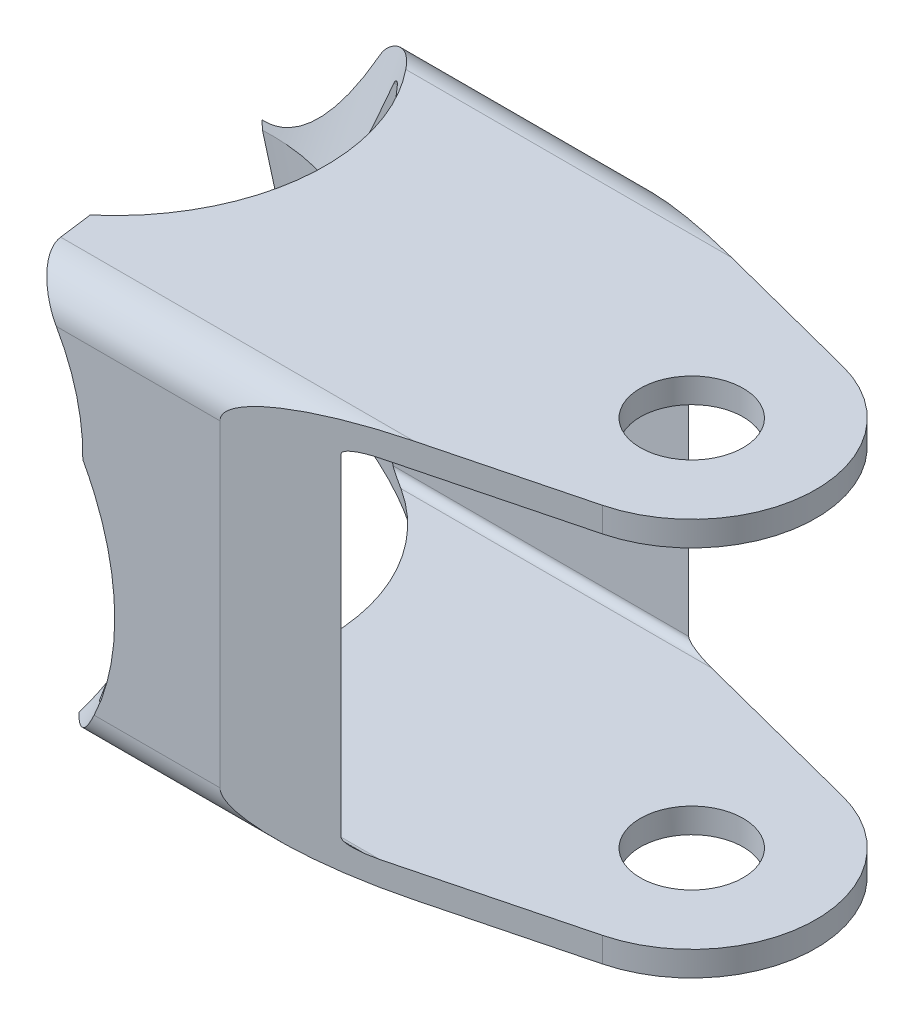
from build123d import *

# Parameters (mm, degrees)
BOSS_EXTRUDE1_DEPTH      = 25.4
BOSS_EXTRUDE1_DEPTH_BACK = 34.925
CUT_EXTRUDE4_DEPTH       = 63.941922635
CUT_EXTRUDE5_DEPTH       = 46.01339384
SKETCH14_R               = 3.2893
CUT_EXTRUDE6_DEPTH       = 46.01339384
CUT_EXTRUDE7_DEPTH       = 76.2
CUT_EXTRUDE7_DEPTH_BACK  = 12.7
SKETCH15_R               = 12.7
CUT_EXTRUDE8_DEPTH       = 10.668
CUT_EXTRUDE8_DEPTH_BACK  = 25.4
SKETCH16_R               = 12.7
CUT_EXTRUDE9_DEPTH       = 13.462
CUT_EXTRUDE9_DEPTH_BACK  = 25.4
SKETCH17_R               = 12.7
CUT_EXTRUDE10_DEPTH      = 11.43
CUT_EXTRUDE10_DEPTH_BACK = 25.4
SKETCH18_R               = 12.7
CUT_EXTRUDE11_DEPTH      = 10.668
CUT_EXTRUDE11_DEPTH_BACK = 25.4
SKETCH19_R               = 12.7
SKETCH20_W               = 46.918980947
SKETCH20_H               = 36.132247669
CUT_EXTRUDE12_DEPTH      = 51.98499249


with BuildPart() as part:
    # Sketch1 → Boss-Extrude1 (new, two sides: drawn at the far end of the back side and taken through both)
    with BuildSketch(Plane(origin=(0, 0, 0), x_dir=(0, 0, -1), z_dir=(1, 0, 0)).offset(-BOSS_EXTRUDE1_DEPTH_BACK)):
        with BuildLine():
            Line((-10.16, 12.7), (10.16, 12.7))
            ThreePointArc((10.16, 12.7), (11.956051224, 11.956051224), (12.7, 10.16))
            Line((12.7, 10.16), (12.7, -10.16))
            ThreePointArc((12.7, -10.16), (11.956051224, -11.956051224), (10.16, -12.7))
            Line((10.16, -12.7), (-10.16, -12.7))
            ThreePointArc((-10.16, -12.7), (-11.956051224, -11.956051224), (-12.7, -10.16))
            Line((-12.7, -10.16), (-12.7, 10.16))
            ThreePointArc((-12.7, 10.16), (-11.956051224, 11.956051224), (-10.16, 12.7))
        make_face()
    extrude(amount=BOSS_EXTRUDE1_DEPTH + BOSS_EXTRUDE1_DEPTH_BACK)

    # Sketch11 → Cut-Extrude4 (cut, through all)
    with BuildSketch(Plane(origin=(25.4, 0, 0), x_dir=(0, 0, -1), z_dir=(1, 0, 0))):
        with BuildLine():
            Line((-10.6045, 11.1125), (10.6045, 11.1125))
            ThreePointArc((10.6045, 11.1125), (10.963710245, 10.963710245), (11.1125, 10.6045))
            Line((11.1125, 10.6045), (11.1125, -10.6045))
            ThreePointArc((11.1125, -10.6045), (10.963710245, -10.963710245), (10.6045, -11.1125))
            Line((10.6045, -11.1125), (-10.6045, -11.1125))
            ThreePointArc((-10.6045, -11.1125), (-10.963710245, -10.963710245), (-11.1125, -10.6045))
            Line((-11.1125, -10.6045), (-11.1125, 10.6045))
            ThreePointArc((-11.1125, 10.6045), (-10.963710245, 10.963710245), (-10.6045, 11.1125))
        make_face()
    extrude(amount=-CUT_EXTRUDE4_DEPTH, mode=Mode.SUBTRACT)

    # Sketch12 → Cut-Extrude5 (cut, through all)
    with BuildSketch(Plane(origin=(0, 12.7, 0), x_dir=(1, 0, 0), z_dir=(0, 1, 0))):
        with BuildLine():
            Line((50.8, 12.7), (0, 12.7))
            Line((0, 12.7), (19.444424463, 7.686083637))
            ThreePointArc((19.444424463, 7.686083637), (25.4, 0), (19.444424463, -7.686083637))
            Line((19.444424463, -7.686083637), (0, -12.7))
            Line((0, -12.7), (50.8, -12.7))
            Line((50.8, -12.7), (50.8, 12.7))
        make_face()
    extrude(amount=-CUT_EXTRUDE5_DEPTH, mode=Mode.SUBTRACT)

    # Sketch14 → Cut-Extrude6 (cut, through all)
    with BuildSketch(Plane(origin=(0, 12.7, 0), x_dir=(1, 0, 0), z_dir=(0, 1, 0))):
        with Locations((17.4625, 0)):
            Circle(SKETCH14_R)
    extrude(amount=-CUT_EXTRUDE6_DEPTH, mode=Mode.SUBTRACT)

    # Sketch15 → Cut-Extrude7 (cut, two sides: drawn at the far end of the back side and taken through both)
    with BuildSketch(Plane(origin=(-25.365699209, 12.7, 0.175387953), x_dir=(-0.966128643141705, -0.2580531152287385, -0.0020086368292109116), z_dir=(0.258060932535648, -0.9660993767043435, -0.007519935525699624)).offset(-CUT_EXTRUDE7_DEPTH_BACK)):
        Circle(SKETCH15_R)
    extrude(amount=CUT_EXTRUDE7_DEPTH + CUT_EXTRUDE7_DEPTH_BACK, mode=Mode.SUBTRACT)

    # Sketch16 → Cut-Extrude8 (cut, two sides: drawn at the far end of the back side and taken through both)
    with BuildSketch(Plane(origin=(-21.145247559, 12.7, -1.764300444), x_dir=(-0.9824624854144782, 0.18269743061253008, -0.03727081432952601), z_dir=(-0.18646035705534364, -0.9626355681875568, 0.1963804931937318)).offset(-CUT_EXTRUDE8_DEPTH_BACK)):
        Circle(SKETCH16_R)
    extrude(amount=CUT_EXTRUDE8_DEPTH + CUT_EXTRUDE8_DEPTH_BACK, mode=Mode.SUBTRACT)

    # Sketch17 → Cut-Extrude9 (cut, two sides: drawn at the far end of the back side and taken through both)
    with BuildSketch(Plane(origin=(-34.925, 0.334385976, 0.104098467), x_dir=(0, 0, -1), z_dir=(0.9661266940476223, 0.2580682294444866, 0)).offset(-CUT_EXTRUDE9_DEPTH_BACK)):
        Circle(SKETCH17_R)
    extrude(amount=CUT_EXTRUDE9_DEPTH + CUT_EXTRUDE9_DEPTH_BACK, mode=Mode.SUBTRACT)


with BuildPart() as body_2:
    # of the pieces the cut leaves, the one that is kept (cut_extrude9_keep)
    add(part.part.solids().sort_by_distance((-34.925, -12.7, 10.16))[0])

    # Sketch18 → Cut-Extrude10 (cut, two sides: drawn at the far end of the back side and taken through both)
    with BuildSketch(Plane(origin=(-21.542643879, 3.81098788, 12.7), x_dir=(-0.9940833845942291, 0.0023249747136513278, 0.10859474649476883), z_dir=(-0.1086196320822448, -0.021278093914850475, -0.9938556324968274)).offset(-CUT_EXTRUDE10_DEPTH_BACK)):
        Circle(SKETCH18_R)
    extrude(amount=CUT_EXTRUDE10_DEPTH + CUT_EXTRUDE10_DEPTH_BACK, mode=Mode.SUBTRACT)

    # Sketch19 → Cut-Extrude11 (cut, two sides: drawn at the far end of the back side and taken through both)
    with BuildSketch(Plane(origin=(-19.809355594, -2.656223175, 12.7), x_dir=(-0.9763290145154151, -0.09548845507502762, 0.19407114768234568), z_dir=(-0.2162906734359075, 0.43103175814294675, -0.8760308031438403)).offset(-CUT_EXTRUDE11_DEPTH_BACK)):
        Circle(SKETCH19_R)
    extrude(amount=CUT_EXTRUDE11_DEPTH + CUT_EXTRUDE11_DEPTH_BACK, mode=Mode.SUBTRACT)

    # Sketch20 → Cut-Extrude12 (cut, through all)
    with BuildSketch(Plane(origin=(-20.509915766, -5.478533696, 0), x_dir=(0.2580609325356479, -0.9660993767043435, -0.007519935525699628), z_dir=(-0.9661266940476223, -0.25806822944448654, 0))):
        with Locations((-1.610495454, -1.756475899)):
            Rectangle(SKETCH20_W, SKETCH20_H)
    extrude(amount=CUT_EXTRUDE12_DEPTH, mode=Mode.SUBTRACT)


solid = body_2.part
